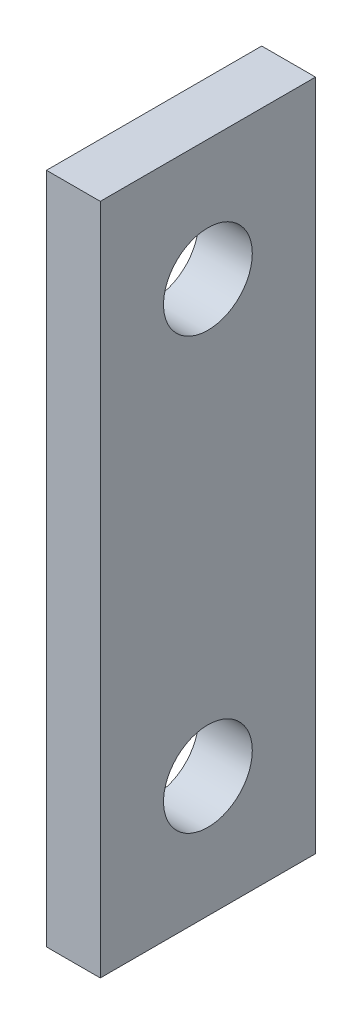
from build123d import *

# Parameters (mm, degrees)
SKETCH1_W           = 125
SKETCH1_H           = 40
SKETCH1_R           = 8.25
BOSS_EXTRUDE1_DEPTH = 5


with BuildPart() as part:
    # Sketch1 → Boss-Extrude1 (new, symmetric)
    with BuildSketch(Plane.YZ):
        Rectangle(SKETCH1_W, SKETCH1_H)
        with Locations(Location((-40, 0, 0), (0, 0, 270))):
            Circle(SKETCH1_R, mode=Mode.SUBTRACT)
        with Locations(Location((40, 0, 0), (0, 0, 270))):
            Circle(SKETCH1_R, mode=Mode.SUBTRACT)
    extrude(amount=BOSS_EXTRUDE1_DEPTH, both=True)


solid = part.part
